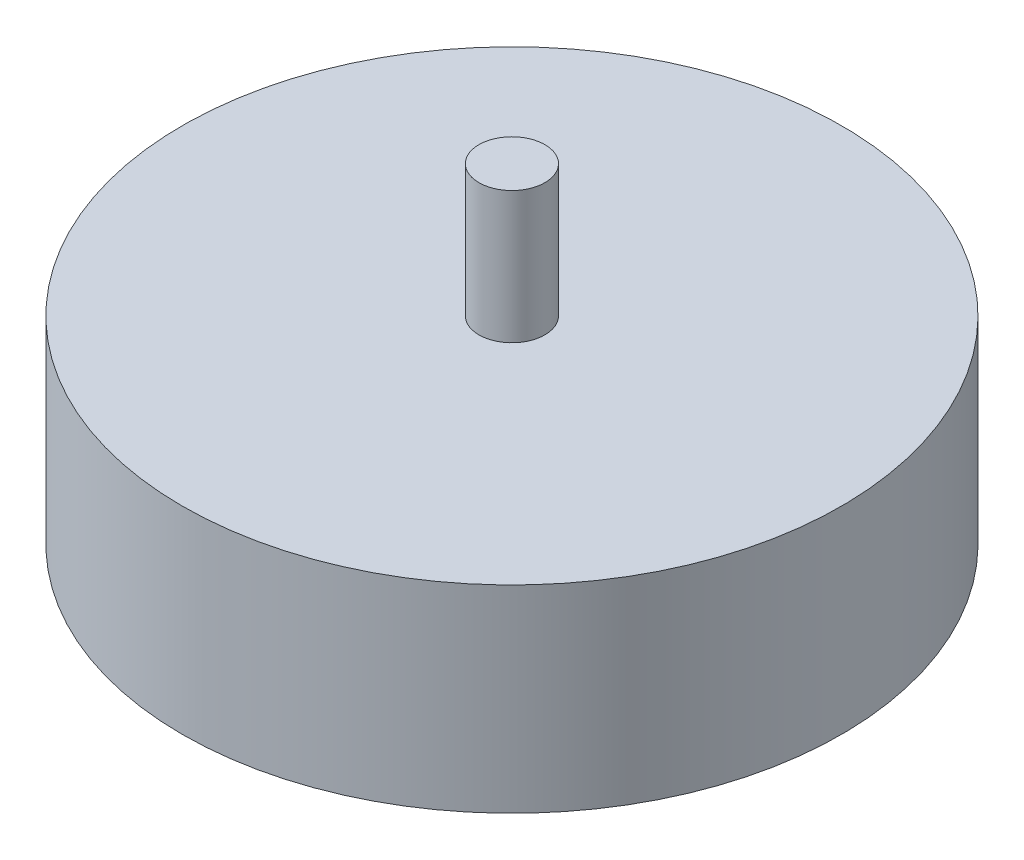
from build123d import *

# Parameters (mm, degrees)
SKETCH1_R           = 25
BOSS_EXTRUDE1_DEPTH = 15
SKETCH2_R           = 4
CUT_EXTRUDE1_DEPTH  = 1
SKETCH3_R           = 2.5
BOSS_EXTRUDE2_DEPTH = 10


with BuildPart() as part:
    # Sketch1 → Boss-Extrude1 (new body)
    with BuildSketch(Plane(origin=(0, 0, 0), x_dir=(1, 0, 0), z_dir=(0, 1, 0))):
        with Locations(Location((0, 0, 0), (0, 0, 270))):
            Circle(SKETCH1_R)
    extrude(amount=BOSS_EXTRUDE1_DEPTH)

    # Sketch2 → Cut-Extrude1 (cut)
    with BuildSketch(Plane.XZ):
        with Locations(Location((0, 0, 0), (0, 0, 270))):
            Circle(SKETCH2_R)
    extrude(amount=-CUT_EXTRUDE1_DEPTH, mode=Mode.SUBTRACT)

    # Sketch3 → Boss-Extrude2 (add)
    with BuildSketch(Plane(origin=(0, 15, 0), x_dir=(1, 0, 0), z_dir=(0, 1, 0))):
        with Locations(Location((0, 0, 0), (0, 0, 270))):
            Circle(SKETCH3_R)
    extrude(amount=BOSS_EXTRUDE2_DEPTH)


solid = part.part
